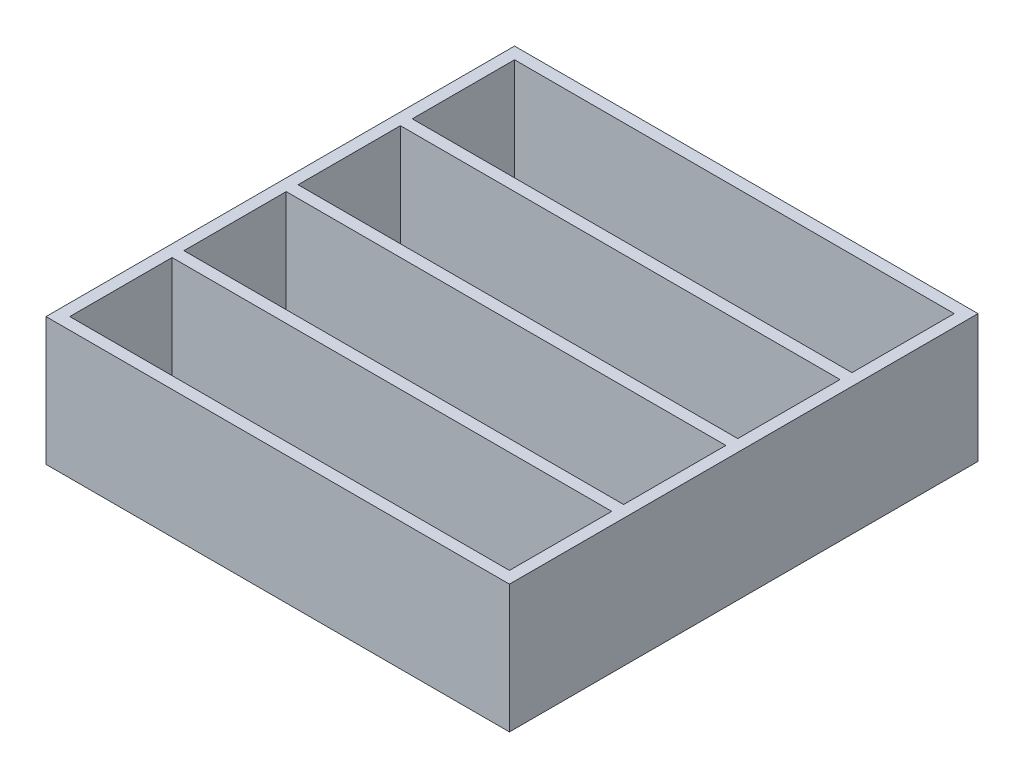
from build123d import *

# Parameters (mm, degrees)
SKETCH1_W           = 77.98
SKETCH1_H           = 78.84
BOSS_EXTRUDE1_DEPTH = 21.54
SKETCH4_W           = 73.98
SKETCH4_H           = 17.21
CUT_EXTRUDE2_DEPTH  = 19.54


with BuildPart() as part:
    # Sketch1 → Boss-Extrude1 (new body)
    with BuildSketch(Plane(origin=(0, 0, 0), x_dir=(1, 0, 0), z_dir=(0, 1, 0))):
        with Locations((-26.481730769, 21.036634615)):
            Rectangle(SKETCH1_W, SKETCH1_H)
    extrude(amount=BOSS_EXTRUDE1_DEPTH)

    # Sketch4 → Cut-Extrude2 (cut)
    with BuildSketch(Plane(origin=(0, 21.54, 0), x_dir=(1, 0, 0), z_dir=(0, 1, 0))):
        with Locations((-26.481730769, -7.778365385)):
            Rectangle(SKETCH4_W, SKETCH4_H)
        with Locations((-26.481730769, 11.431634615)):
            Rectangle(SKETCH4_W, SKETCH4_H)
        with Locations((-26.481730769, 30.641634615)):
            Rectangle(SKETCH4_W, SKETCH4_H)
        with Locations((-26.481730769, 49.851634615)):
            Rectangle(SKETCH4_W, SKETCH4_H)
    extrude(amount=-CUT_EXTRUDE2_DEPTH, mode=Mode.SUBTRACT)


solid = part.part
